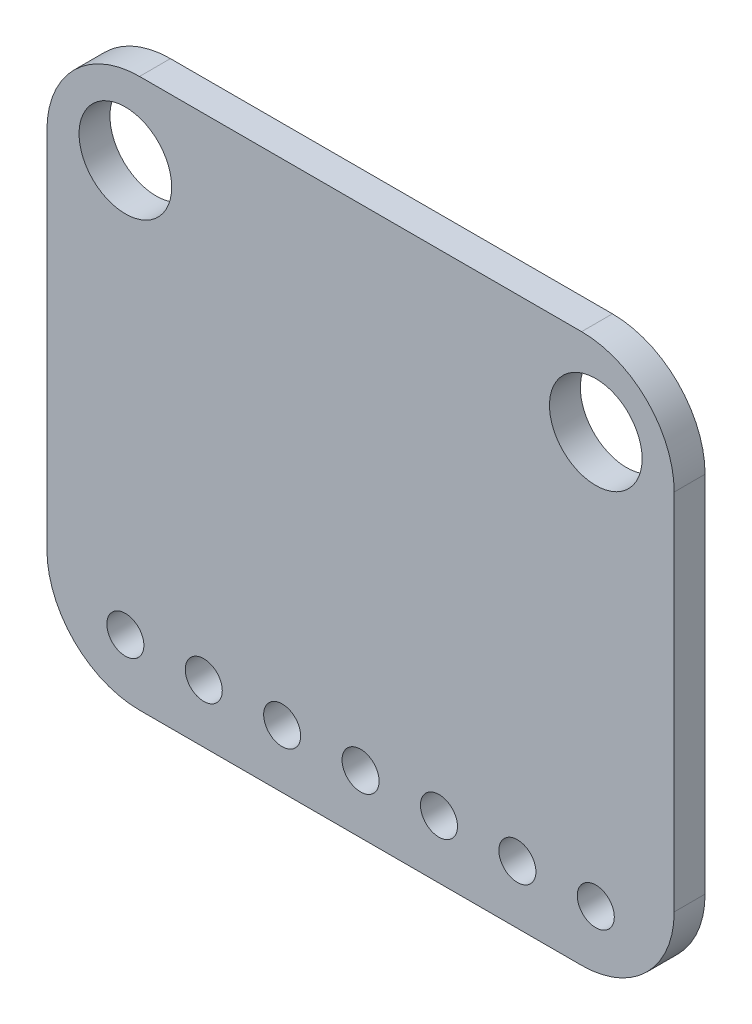
from build123d import *

# Parameters (mm, degrees)
SKETCH_1_W           = 20.32
SKETCH_1_H           = 17.78
SKETCH_1_R           = 1.5
SKETCH_1_R_2         = 0.6
EXTRUDE_1_DEPTH      = 1
FILLET_2_R           = 3
FILLET_3_R           = 3
FILLET_4_R           = 3
FILLET_5_R           = 3
EXTRUDE_2_DEPTH      = 1
EXTRUDE_2_DEPTH_BACK = 1
SKETCH_2_W           = 3.580076994
SKETCH_2_H           = 6.056150923


with BuildPart() as part:
    # 草图1 → 凸台-拉伸1 (new body)
    with BuildSketch(Plane.XY):
        Rectangle(SKETCH_1_W, SKETCH_1_H)
        with Locations((-7.62, 6.303875277)):
            Circle(SKETCH_1_R, mode=Mode.SUBTRACT)
        with Locations((7.62, 6.303875277)):
            Circle(SKETCH_1_R, mode=Mode.SUBTRACT)
        with Locations((-7.62, -7.003605695)):
            Circle(SKETCH_1_R_2, mode=Mode.SUBTRACT)
        with Locations((-5.08, -7.003605695)):
            Circle(SKETCH_1_R_2, mode=Mode.SUBTRACT)
        with Locations((-2.54, -7.003605695)):
            Circle(SKETCH_1_R_2, mode=Mode.SUBTRACT)
        with Locations((0, -7.003605695)):
            Circle(SKETCH_1_R_2, mode=Mode.SUBTRACT)
        with Locations((2.54, -7.003605695)):
            Circle(SKETCH_1_R_2, mode=Mode.SUBTRACT)
        with Locations((5.08, -7.003605695)):
            Circle(SKETCH_1_R_2, mode=Mode.SUBTRACT)
        with Locations((7.62, -7.003605695)):
            Circle(SKETCH_1_R_2, mode=Mode.SUBTRACT)
    extrude(amount=EXTRUDE_1_DEPTH)

    # 圆角2
    fillet_2_edges = [part.edges().sort_by_distance(p)[0] for p in [
        (10.16, 8.89, 0.5),
    ]]
    fillet(fillet_2_edges, radius=FILLET_2_R)

    # 圆角3
    fillet_3_edges = [part.edges().sort_by_distance(p)[0] for p in [
        (-10.16, 8.89, 0.5),
    ]]
    fillet(fillet_3_edges, radius=FILLET_3_R)

    # 圆角4
    fillet_4_edges = [part.edges().sort_by_distance(p)[0] for p in [
        (-10.16, -8.89, 0.5),
    ]]
    fillet(fillet_4_edges, radius=FILLET_4_R)

    # 圆角5
    fillet_5_edges = [part.edges().sort_by_distance(p)[0] for p in [
        (10.16, -8.89, 0.5),
    ]]
    fillet(fillet_5_edges, radius=FILLET_5_R)

    # 草图2 → 凸台-拉伸2 (add, two sides: drawn at the far end of the back side and taken through both)
    with BuildSketch(Plane.XY.offset(-EXTRUDE_2_DEPTH_BACK)):
        with Locations((-0.887963615, 1.742289852)):
            Rectangle(SKETCH_2_W, SKETCH_2_H)
    extrude(amount=EXTRUDE_2_DEPTH + EXTRUDE_2_DEPTH_BACK)


solid = part.part
